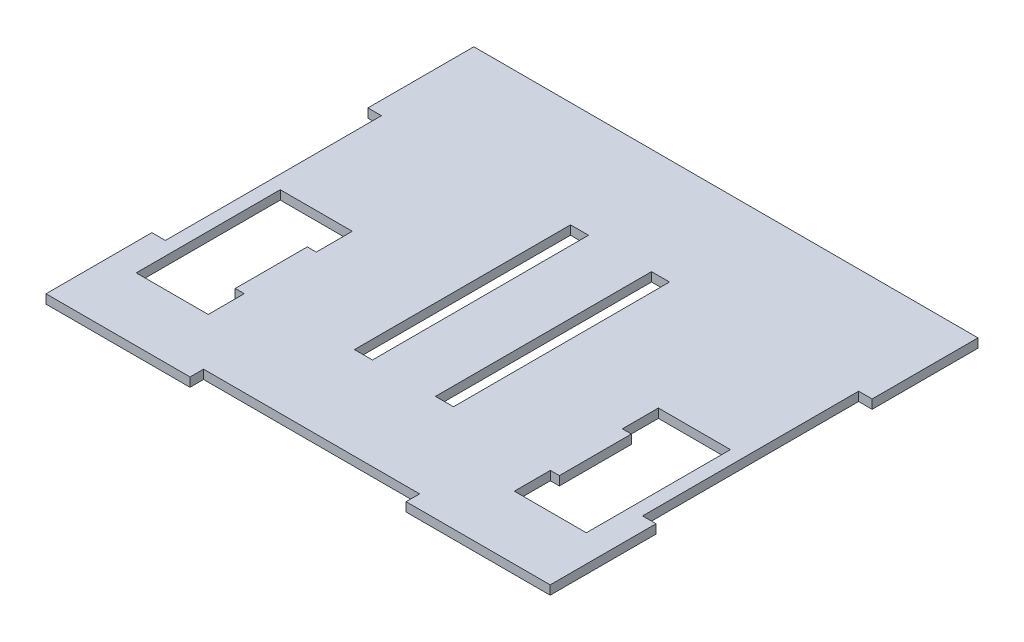
from build123d import *

# Parameters (mm, degrees)
BOSS_EXTRUDE1_DEPTH = 6.35
SKETCH4_W           = 38.1
SKETCH4_H           = 101.6
CUT_EXTRUDE3_DEPTH  = 252.527339468
SKETCH5_W           = 12.7
SKETCH5_H           = 25.4
CUT_EXTRUDE4_DEPTH  = 252.527339468
SKETCH6_W           = 6.35
SKETCH6_H           = 50.8
CUT_EXTRUDE5_DEPTH  = 252.527339468
SKETCH13_W          = 12.7
SKETCH13_H          = 152.4
CUT_EXTRUDE8_DEPTH  = 252.527339468


with BuildPart() as part:
    # Sketch1 → Boss-Extrude1 (new body)
    with BuildSketch(Plane(origin=(0, 0, 0), x_dir=(1, 0, 0), z_dir=(0, 1, 0))):
        Polygon((-177.8, -177.8), (-76.2, -177.8), (-76.2, -168.275), (76.2, -168.275), (76.2, -177.8), (177.8, -177.8), (177.8, -103.124), (168.275, -103.124), (168.275, 49.276), (177.8, 49.276), (177.8, 123.952), (-177.8, 123.952), (-177.8, 49.276), (-168.275, 49.276), (-168.275, -103.124), (-177.8, -103.124), align=None)
    extrude(amount=BOSS_EXTRUDE1_DEPTH)

    # Sketch4 → Cut-Extrude3 (cut, through all)
    with BuildSketch(Plane(origin=(0, 6.35, 0), x_dir=(1, 0, 0), z_dir=(0, 1, 0))):
        with Locations((139.7, -82.423)):
            Rectangle(SKETCH4_W, SKETCH4_H)
        with Locations((-139.7, -82.423)):
            Rectangle(SKETCH4_W, SKETCH4_H)
    extrude(amount=-CUT_EXTRUDE3_DEPTH, mode=Mode.SUBTRACT)

    # Sketch5 → Cut-Extrude4 (cut, through all)
    with BuildSketch(Plane(origin=(0, 6.35, 0), x_dir=(1, 0, 0), z_dir=(0, 1, 0))):
        with Locations((114.3, -120.523)):
            Rectangle(SKETCH5_W, SKETCH5_H)
        with Locations((114.3, -44.323)):
            Rectangle(SKETCH5_W, SKETCH5_H)
        with Locations((-114.3, -44.323)):
            Rectangle(SKETCH5_W, SKETCH5_H)
        with Locations((-114.3, -120.523)):
            Rectangle(SKETCH5_W, SKETCH5_H)
    extrude(amount=-CUT_EXTRUDE4_DEPTH, mode=Mode.SUBTRACT)

    # Sketch6 → Cut-Extrude5 (cut, through all)
    with BuildSketch(Plane(origin=(0, 6.35, 0), x_dir=(1, 0, 0), z_dir=(0, 1, 0))):
        with Locations((117.475, -82.423)):
            Rectangle(SKETCH6_W, SKETCH6_H)
        with Locations((-117.475, -82.423)):
            Rectangle(SKETCH6_W, SKETCH6_H)
    extrude(amount=-CUT_EXTRUDE5_DEPTH, mode=Mode.SUBTRACT)

    # Sketch13 → Cut-Extrude8 (cut, through all)
    with BuildSketch(Plane(origin=(0, 6.35, 0), x_dir=(1, 0, 0), z_dir=(0, 1, 0))):
        with Locations((-28.575, -26.924)):
            Rectangle(SKETCH13_W, SKETCH13_H)
        with Locations((28.575, -26.924)):
            Rectangle(SKETCH13_W, SKETCH13_H)
    extrude(amount=-CUT_EXTRUDE8_DEPTH, mode=Mode.SUBTRACT)


solid = part.part
